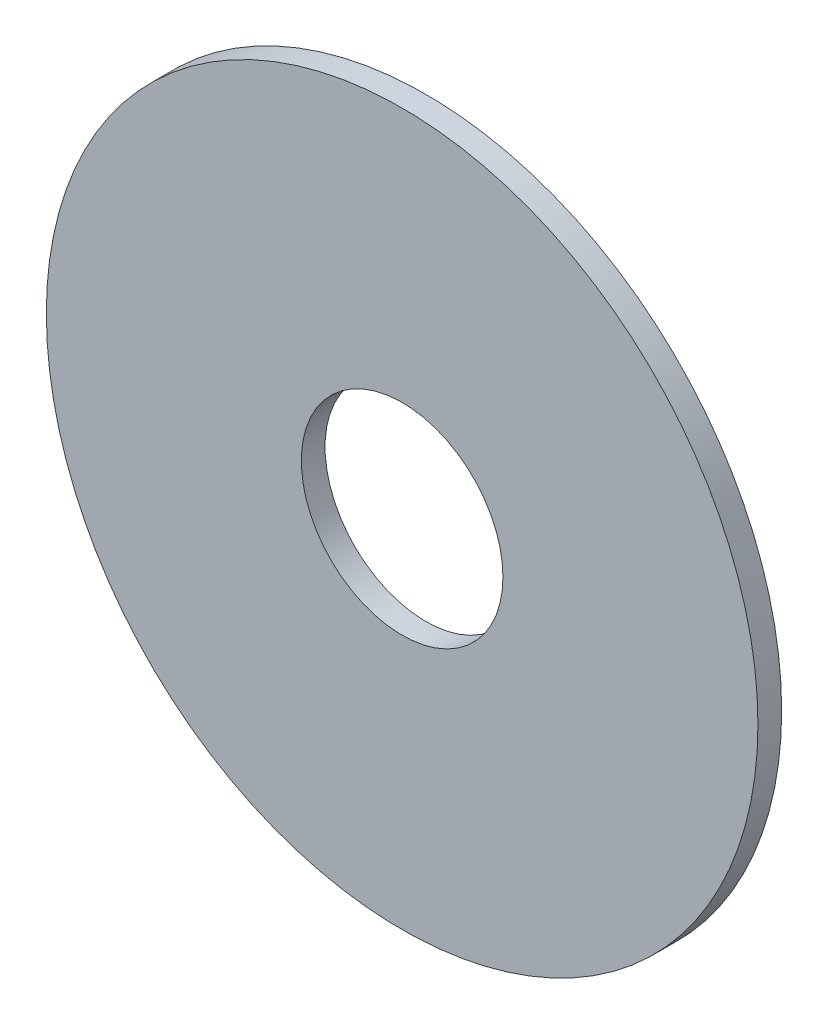
from build123d import *

# Parameters (mm, degrees)
SKETCH1_R           = 15
SKETCH1_R_2         = 4.25
BOSS_EXTRUDE1_DEPTH = 1


with BuildPart() as part:
    # Sketch1 → Boss-Extrude1 (new body)
    with BuildSketch(Plane.XY):
        Circle(SKETCH1_R)
        Circle(SKETCH1_R_2, mode=Mode.SUBTRACT)
    extrude(amount=BOSS_EXTRUDE1_DEPTH)


solid = part.part
